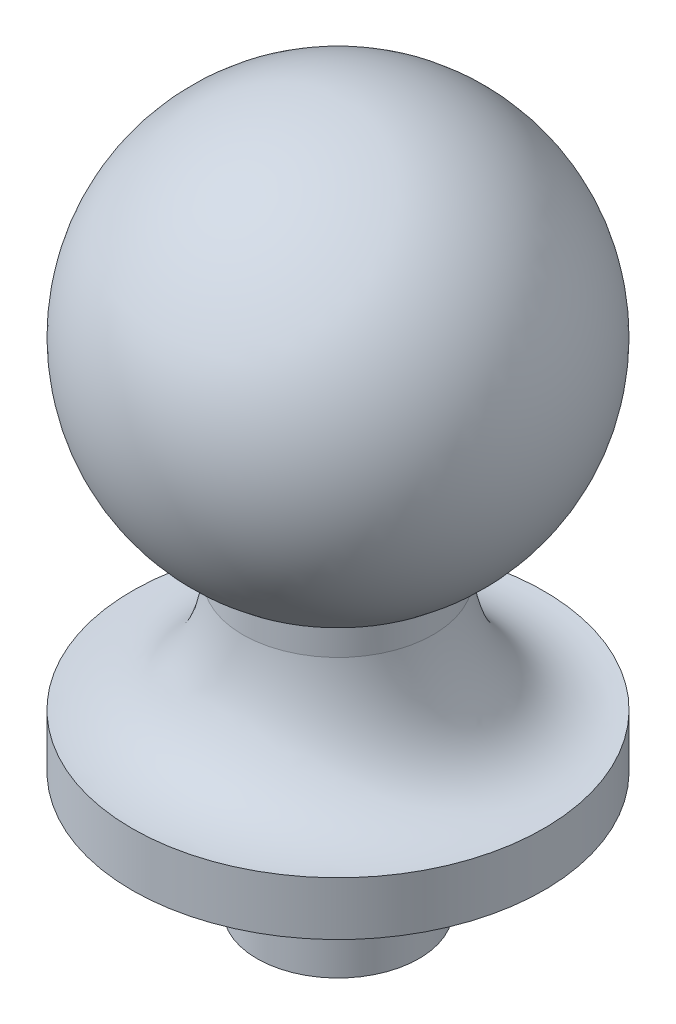
from build123d import *

# Parameters (mm, degrees)
SKETCH1_W = 10
SKETCH1_H = 15


with BuildPart() as part:
    # Sketch1 → Revolve2 (revolve)
    with BuildSketch(Plane(origin=(0, 0, 0), x_dir=(0, 0, -1), z_dir=(1, 0, 0))):
        with BuildLine():
            Line((0, 25.4), (0, -25.4))
            ThreePointArc((0, -25.4), (-25.4, 0), (0, 25.4))
        make_face()
        with BuildLine():
            Line((0, -46.453146802), (0, -25.4))
            ThreePointArc((0, -25.4), (-6.051284035, -24.668643285), (-11.754091911, -22.516689884))
            Line((-11.754091911, -22.516689884), (-11.754091911, -25.953962773))
            add(Edge.make_bspline(
                [(-11.754091911, -25.953962773), (-13.625124372, -40.663791469), (-25.4, -39.846348213)],
                knots=[0, 0, 0, 1, 1, 1], degree=2))
            Line((-25.4, -39.846348213), (-25.4, -46.453146802))
            Line((-25.4, -46.453146802), (-10, -46.453146802))
            Line((-10, -46.453146802), (0, -46.453146802))
        make_face()
        with Locations((-5, -53.953146802)):
            Rectangle(SKETCH1_W, SKETCH1_H)
    revolve(axis=Axis((0, 38.955963628, 0), (0, -1, 0)))


solid = part.part
